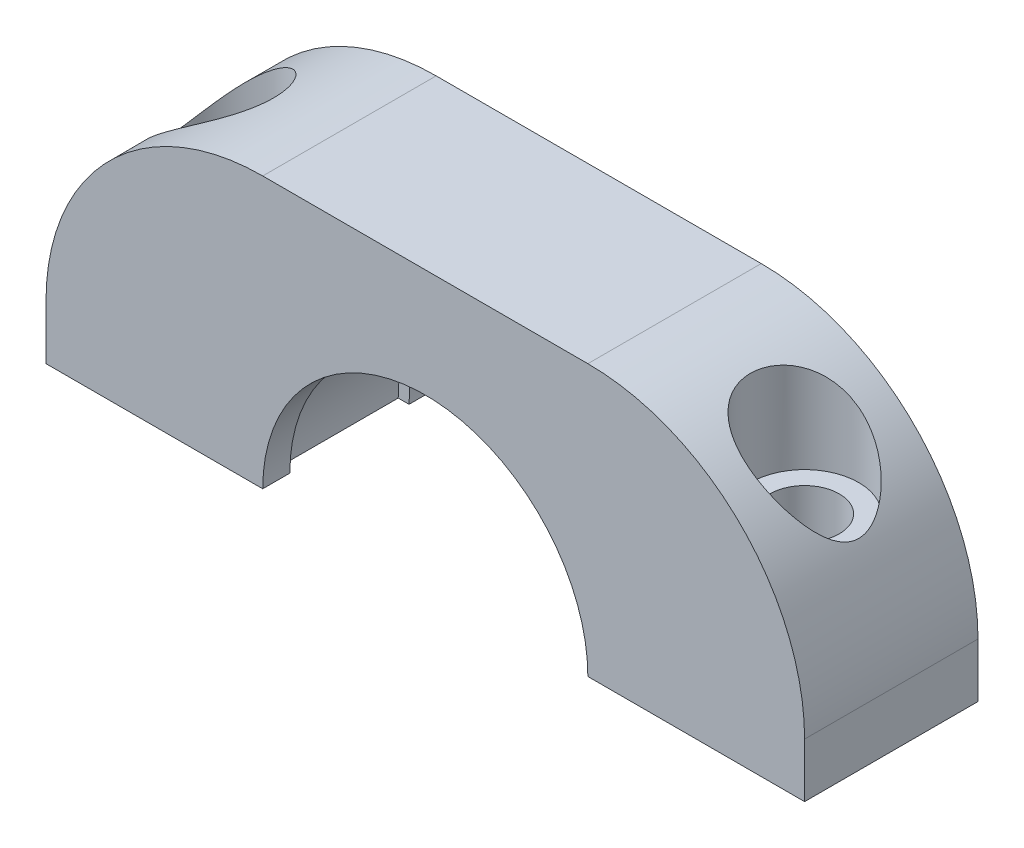
from build123d import *

# Parameters (mm, degrees)
SKETCH1_W           = 35
SKETCH1_H           = 8
BOSS_EXTRUDE1_DEPTH = 12.5
CUT_EXTRUDE1_REACH  = 24.946
SKETCH2_R           = 7.5
FILLET1_R           = 10
SKETCH3_R           = 8
CUT_EXTRUDE2_DEPTH  = 2.75
SKETCH4_R           = 1.6
CUT_EXTRUDE3_DEPTH  = 22.874642854
SKETCH5_R           = 2.5
CUT_EXTRUDE4_DEPTH  = 20.455076607


with BuildPart() as part:
    # Sketch1 → Boss-Extrude1 (new body)
    with BuildSketch(Plane(origin=(0, 0, 0), x_dir=(1, 0, 0), z_dir=(0, 1, 0))):
        Rectangle(SKETCH1_W, SKETCH1_H)
    extrude(amount=BOSS_EXTRUDE1_DEPTH)

    # Sketch2 → Cut-Extrude1 (cut, up to next)
    with BuildSketch(Plane.XY.offset(4), mode=Mode.PRIVATE) as cut_extrude1_sk1:
        Circle(SKETCH2_R)
    cut_extrude1_tool1 = extrude(cut_extrude1_sk1.sketch, amount=-CUT_EXTRUDE1_REACH, mode=Mode.PRIVATE) & part.part
    add(cut_extrude1_tool1.solids().sort_by_distance((0, 0, 4))[0], mode=Mode.SUBTRACT)

    # Fillet1
    fillet1_edges = [part.edges().sort_by_distance(p)[0] for p in [
        (-17.5, 12.5, 0),
        (17.5, 12.5, 0),
    ]]
    fillet(fillet1_edges, radius=FILLET1_R)

    # Sketch3 → Cut-Extrude2 (cut, symmetric)
    with BuildSketch(Plane.XY):
        Circle(SKETCH3_R)
    extrude(amount=CUT_EXTRUDE2_DEPTH, both=True, mode=Mode.SUBTRACT)

    # Sketch4 → Cut-Extrude3 (cut, through all)
    with BuildSketch(Plane.XZ):
        with Locations(Location((13.5, 0, 0), (0, 0, 270))):
            Circle(SKETCH4_R)
        with Locations(Location((-13.5, 0, 0), (0, 0, 270))):
            Circle(SKETCH4_R)
    extrude(amount=-CUT_EXTRUDE3_DEPTH, mode=Mode.SUBTRACT)

    # Sketch5 → Cut-Extrude4 (cut, through all)
    with BuildSketch(Plane(origin=(0, 7.5, 0), x_dir=(-1, 0, 0), z_dir=(0, -1, 0))):
        with Locations(Location((-13.5, 0, 0), (0, 0, 90))):
            Circle(SKETCH5_R)
        with Locations(Location((13.5, 0, 0), (0, 0, 90))):
            Circle(SKETCH5_R)
    extrude(amount=-CUT_EXTRUDE4_DEPTH, mode=Mode.SUBTRACT)


solid = part.part
